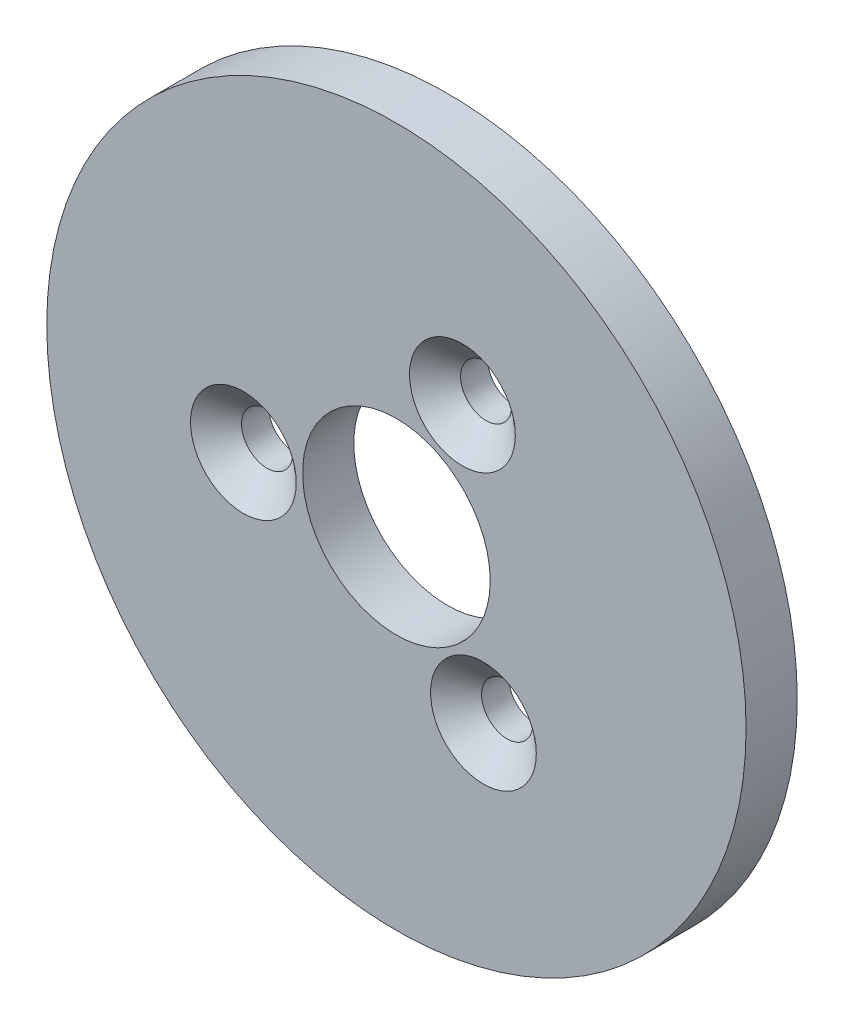
from build123d import *

# Parameters (mm, degrees)
SKETCH1_R           = 20.5
BOSS_EXTRUDE1_DEPTH = 3
SKETCH2_R           = 1.5
CUT_EXTRUDE1_DEPTH  = 30.146183284
CHAMFER1_SIZE       = 1.6
CHAMFER1_SIZE2      = 1.390858781
SKETCH3_R           = 5.5
CUT_EXTRUDE2_DEPTH  = 30.146183284


with BuildPart() as part:
    # Sketch1 → Boss-Extrude1 (new body)
    with BuildSketch(Plane.XY):
        Circle(SKETCH1_R)
    extrude(amount=BOSS_EXTRUDE1_DEPTH)

    # Sketch2 → Cut-Extrude1 (cut, through all)
    with BuildSketch(Plane.XY.offset(3)):
        with Locations((-8.971859678, -0.711149714)):
            Circle(SKETCH2_R)
        with Locations((5.101803557, -7.414283544)):
            Circle(SKETCH2_R)
        with Locations((3.870056121, 8.125433257)):
            Circle(SKETCH2_R)
    extrude(amount=-CUT_EXTRUDE1_DEPTH, mode=Mode.SUBTRACT)

    # Chamfer1
    chamfer1_edges = [part.edges().sort_by_distance(p)[0] for p in [
        (3.601803557, -7.414283544, 3),
        (2.370056121, 8.125433257, 3),
        (-10.471859678, -0.711149714, 3),
    ]]
    chamfer1_side = [part.faces().sort_by_distance(p)[0] for p in [
        (0, 0, 3),
    ]]
    chamfer(chamfer1_edges, length=CHAMFER1_SIZE, length2=CHAMFER1_SIZE2, reference=chamfer1_side[0])

    # Sketch3 → Cut-Extrude2 (cut, through all)
    with BuildSketch(Plane.XY.offset(3)):
        Circle(SKETCH3_R)
    extrude(amount=-CUT_EXTRUDE2_DEPTH, mode=Mode.SUBTRACT)


solid = part.part
